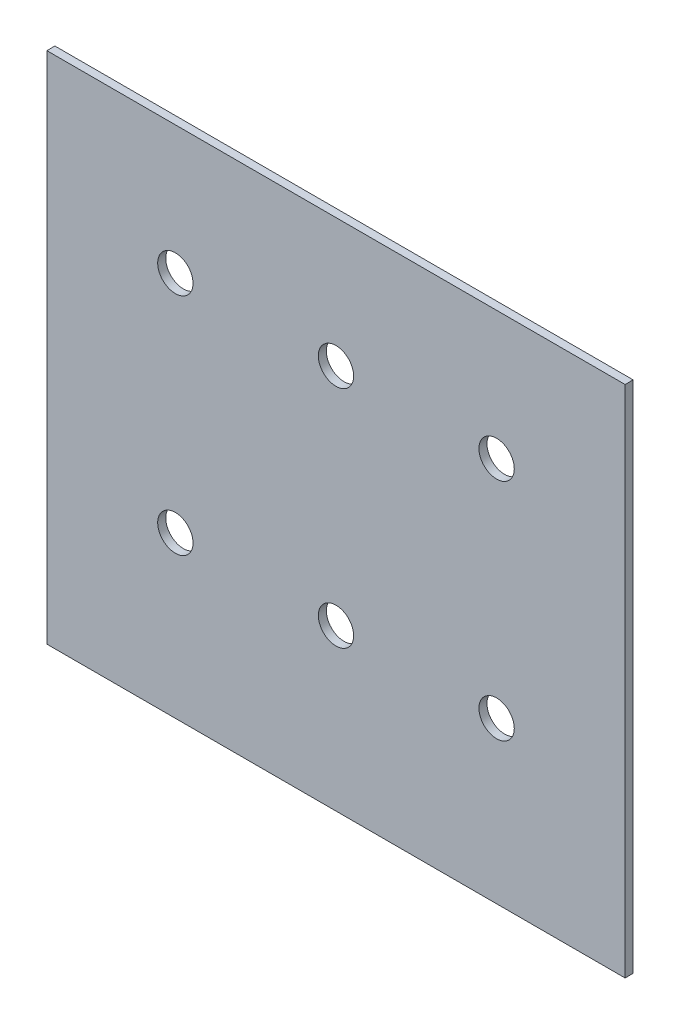
from build123d import *

# Parameters (mm, degrees)
ESBO_O1_W                = 360
ESBO_O1_H                = 320
ESBO_O1_R                = 11
RESSALTO_EXTRUS_O1_DEPTH = 5


with BuildPart() as part:
    # Esboço1 → Ressalto-extrusão1 (new body)
    with BuildSketch(Plane.XY):
        Rectangle(ESBO_O1_W, ESBO_O1_H)
        with Locations((0, 80)):
            Circle(ESBO_O1_R, mode=Mode.SUBTRACT)
        with Locations((-100, 80)):
            Circle(ESBO_O1_R, mode=Mode.SUBTRACT)
        with Locations((100, 80)):
            Circle(ESBO_O1_R, mode=Mode.SUBTRACT)
        with Locations((0, -60)):
            Circle(ESBO_O1_R, mode=Mode.SUBTRACT)
        with Locations((100, -60)):
            Circle(ESBO_O1_R, mode=Mode.SUBTRACT)
        with Locations((-100, -60)):
            Circle(ESBO_O1_R, mode=Mode.SUBTRACT)
    extrude(amount=RESSALTO_EXTRUS_O1_DEPTH)


solid = part.part
